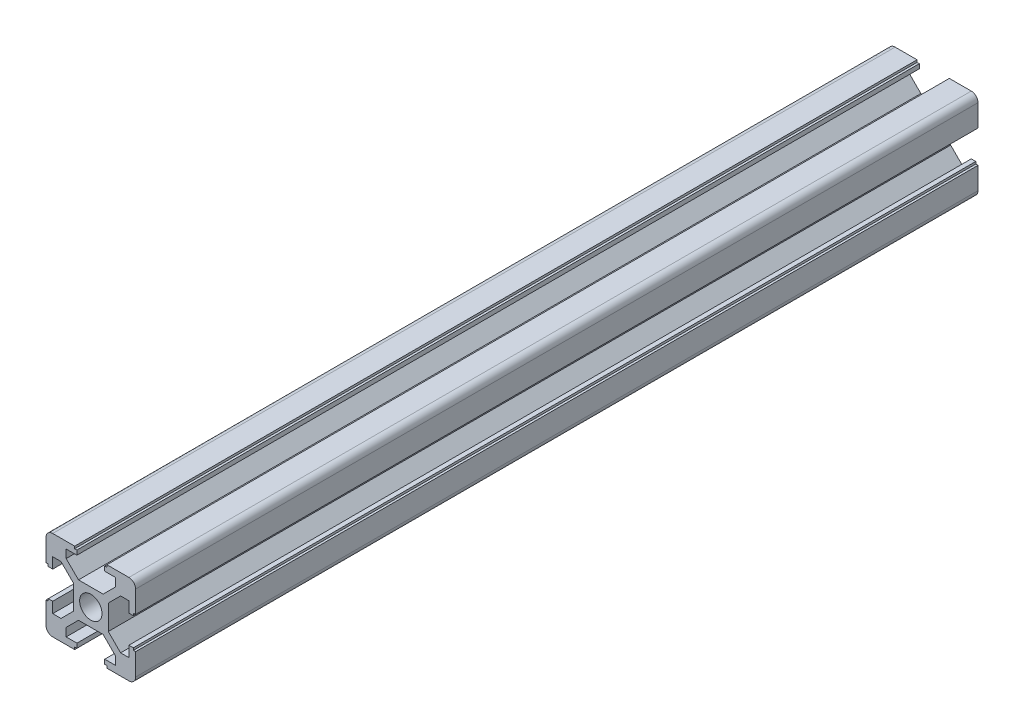
from build123d import *

# Parameters (mm, degrees)
SKETCH1_R           = 2.5
EXTRUDE_1_DEPTH     = 188
SKETCH_1_R          = 2.2
CUT_EXTRUDE_1_DEPTH = 189.778203191


with BuildPart() as part:
    # Sketch1 → 凸台-拉伸1 (new body)
    with BuildSketch(Plane.XY):
        with BuildLine():
            Line((-3.6, 10), (-3.6, 9.5))
            Line((-3.6, 9.5), (-3.1, 9.5))
            Line((-3.1, 9.5), (-3.1, 8.5))
            Line((-3.1, 8.5), (-5.5, 8.5))
            Line((-5.5, 8.5), (-5.5, 6.65))
            Line((-5.5, 6.65), (-2.75, 3.9))
            Line((-2.75, 3.9), (2.75, 3.9))
            Line((2.75, 3.9), (5.5, 6.65))
            Line((5.5, 6.65), (5.5, 8.5))
            Line((5.5, 8.5), (3.1, 8.5))
            Line((3.1, 8.5), (3.1, 9.5))
            Line((3.1, 9.5), (3.6, 9.5))
            Line((3.6, 9.5), (3.6, 10))
            Line((3.6, 10), (8.5, 10))
            ThreePointArc((8.5, 10), (9.560660172, 9.560660172), (10, 8.5))
            Line((10, 8.5), (10, 3.6))
            Line((10, 3.6), (9.5, 3.6))
            Line((9.5, 3.6), (9.5, 3.1))
            Line((9.5, 3.1), (8.5, 3.1))
            Line((8.5, 3.1), (8.5, 5.5))
            Line((8.5, 5.5), (6.65, 5.5))
            Line((6.65, 5.5), (3.9, 2.75))
            Line((3.9, 2.75), (3.9, -2.75))
            Line((3.9, -2.75), (6.65, -5.5))
            Line((6.65, -5.5), (8.5, -5.5))
            Line((8.5, -5.5), (8.5, -3.1))
            Line((8.5, -3.1), (9.5, -3.1))
            Line((9.5, -3.1), (9.5, -3.6))
            Line((9.5, -3.6), (10, -3.6))
            Line((10, -3.6), (10, -8.5))
            ThreePointArc((10, -8.5), (9.560660172, -9.560660172), (8.5, -10))
            Line((8.5, -10), (3.6, -10))
            Line((3.6, -10), (3.6, -9.5))
            Line((3.6, -9.5), (3.1, -9.5))
            Line((3.1, -9.5), (3.1, -8.5))
            Line((3.1, -8.5), (5.5, -8.5))
            Line((5.5, -8.5), (5.5, -6.65))
            Line((5.5, -6.65), (2.75, -3.9))
            Line((2.75, -3.9), (-2.75, -3.9))
            Line((-2.75, -3.9), (-5.5, -6.65))
            Line((-5.5, -6.65), (-5.5, -8.5))
            Line((-5.5, -8.5), (-3.1, -8.5))
            Line((-3.1, -8.5), (-3.1, -9.5))
            Line((-3.1, -9.5), (-3.6, -9.5))
            Line((-3.6, -9.5), (-3.6, -10))
            Line((-3.6, -10), (-8.5, -10))
            ThreePointArc((-8.5, -10), (-9.560660172, -9.560660172), (-10, -8.5))
            Line((-10, -8.5), (-10, -3.6))
            Line((-10, -3.6), (-9.5, -3.6))
            Line((-9.5, -3.6), (-9.5, -3.1))
            Line((-9.5, -3.1), (-8.5, -3.1))
            Line((-8.5, -3.1), (-8.5, -5.5))
            Line((-8.5, -5.5), (-6.65, -5.5))
            Line((-6.65, -5.5), (-3.9, -2.75))
            Line((-3.9, -2.75), (-3.9, 2.75))
            Line((-3.9, 2.75), (-6.65, 5.5))
            Line((-6.65, 5.5), (-8.5, 5.5))
            Line((-8.5, 5.5), (-8.5, 3.1))
            Line((-8.5, 3.1), (-9.5, 3.1))
            Line((-9.5, 3.1), (-9.5, 3.6))
            Line((-9.5, 3.6), (-10, 3.6))
            Line((-10, 3.6), (-10, 8.5))
            ThreePointArc((-10, 8.5), (-9.560660172, 9.560660172), (-8.5, 10))
            Line((-8.5, 10), (-3.6, 10))
        make_face()
        Circle(SKETCH1_R, mode=Mode.SUBTRACT)
    extrude(amount=EXTRUDE_1_DEPTH)

    # 草图1 → 切除-拉伸1 (cut, through all)
    with BuildSketch(Plane(origin=(0, 3.9, 0), x_dir=(1, 0, 0), z_dir=(0, 1, 0))):
        with Locations(Location((0, -32, 0), (0, 0, 180))):
            Circle(SKETCH_1_R)
        with Locations(Location((0, -56, 0), (0, 0, 180))):
            Circle(SKETCH_1_R)
        with Locations(Location((0, -106, 0), (0, 0, 180))):
            Circle(SKETCH_1_R)
        with Locations(Location((0, -132, 0), (0, 0, 180))):
            Circle(SKETCH_1_R)
        with Locations(Location((0, -156, 0), (0, 0, 180))):
            Circle(SKETCH_1_R)
        with Locations(Location((0, -82, 0), (0, 0, 180))):
            Circle(SKETCH_1_R)
    extrude(amount=-CUT_EXTRUDE_1_DEPTH, mode=Mode.SUBTRACT)


solid = part.part
